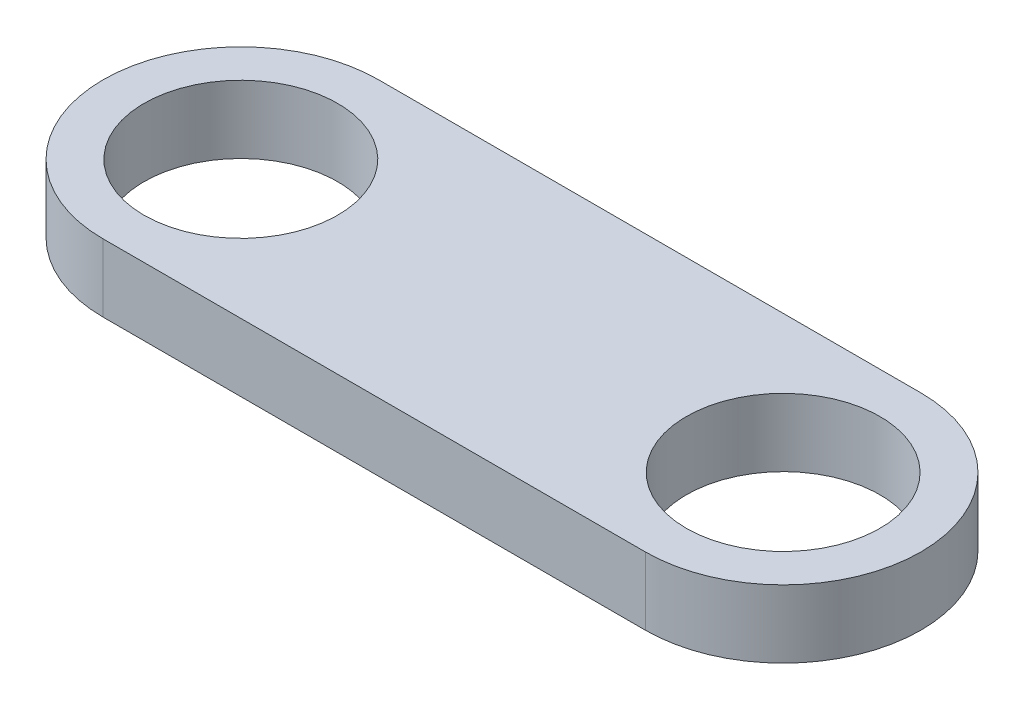
from build123d import *

# Parameters (mm, degrees)
SKETCH1_R           = 22.860716869
BOSS_EXTRUDE1_DEPTH = 16.002


with BuildPart() as part:
    # Sketch1 → Boss-Extrude1 (new body)
    with BuildSketch(Plane(origin=(0, 0, 0), x_dir=(1, 0, 0), z_dir=(0, 1, 0))):
        with BuildLine():
            Line((-64, 32.51538958), (64, 32.51538958))
            ThreePointArc((64, 32.51538958), (96.51538958, 0), (64, -32.51538958))
            Line((64, -32.51538958), (-64, -32.51538958))
            ThreePointArc((-64, -32.51538958), (-96.51538958, 0), (-64, 32.51538958))
        make_face()
        with Locations(Location((-64, 0, 0), (0, 0, 270))):
            Circle(SKETCH1_R, mode=Mode.SUBTRACT)
        with Locations(Location((64, 0, 0), (0, 0, 270))):
            Circle(SKETCH1_R, mode=Mode.SUBTRACT)
    extrude(amount=BOSS_EXTRUDE1_DEPTH)


solid = part.part
